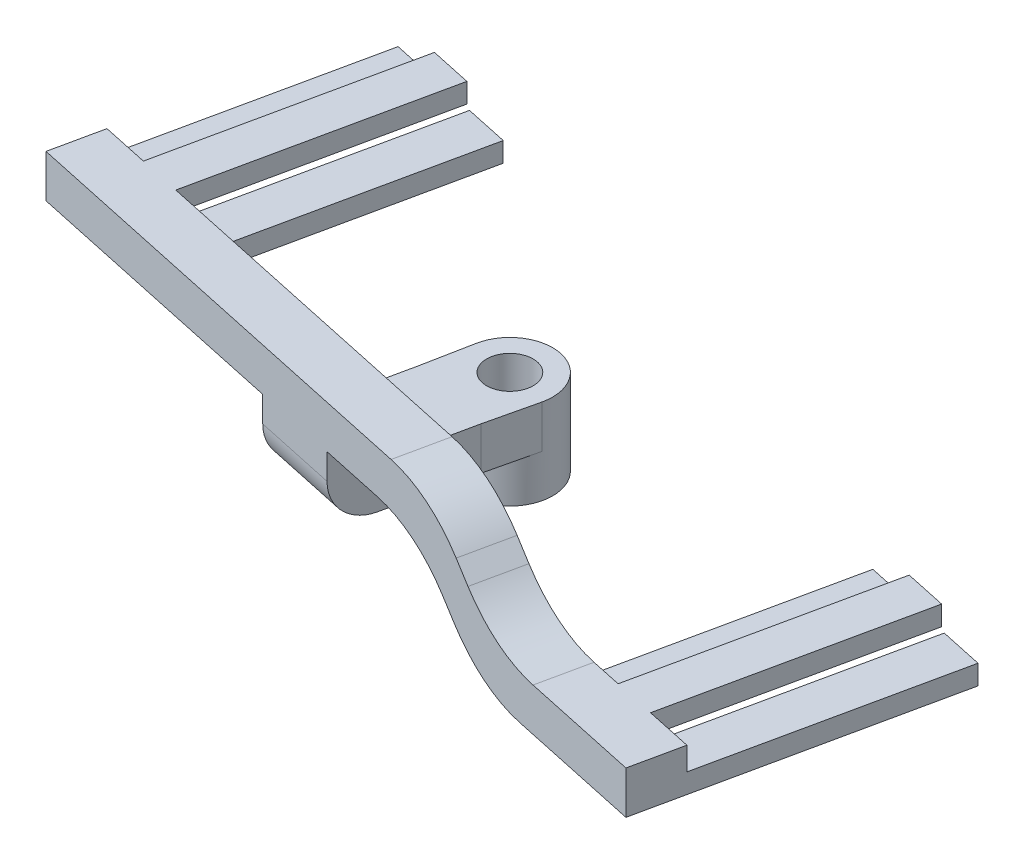
from build123d import *

# Parameters (mm, degrees)
SKETCH1_R             = 3.175
BOSS_EXTRUDE1_DEPTH   = 8.89
F_4_CLEARANCE_HOLE1_D = 3.4544
BOSS_EXTRUDE2_START   = -3.175
BOSS_EXTRUDE2_DEPTH   = 3.175
BOSS_EXTRUDE3_DEPTH   = 3.81
BOSS_EXTRUDE4_START   = -9.525
BOSS_EXTRUDE4_DEPTH   = 3.175
CUT_EXTRUDE1_DEPTH    = 18.185920344
CUT_EXTRUDE2_DEPTH    = 5.08
BOSS_EXTRUDE5_START   = -20.938172
BOSS_EXTRUDE5_DEPTH   = 6.208698
BOSS_EXTRUDE6_DEPTH   = 3.175
FILLET2_R             = 8.89
FILLET3_R             = 1.5875
FILLET4_R             = 3.175
SKETCH16_R            = 3.175
SKETCH16_R_2          = 1.7272
BOSS_EXTRUDE7_DEPTH   = 2.54


with BuildPart() as part:
    # Sketch1 → Boss-Extrude1 (new body)
    with BuildSketch(Plane(origin=(0, 0, 0), x_dir=(1, 0, 0), z_dir=(0, 1, 0))):
        with Locations(Location((0, 0, 0), (0, 0, 270))):
            Circle(SKETCH1_R)
    extrude(amount=BOSS_EXTRUDE1_DEPTH)

    # #4 Clearance Hole1 (through all)
    with Locations(Plane(origin=(0, 8.89, 0), x_dir=(1, 0, 0), z_dir=(0, 1, 0))):
        with Locations((0, 0)):
            Hole(F_4_CLEARANCE_HOLE1_D / 2)

    # Sketch5 → Boss-Extrude2 (add)
    with BuildSketch(Plane(origin=(0, 8.89, 0), x_dir=(1, 0, 0), z_dir=(0, 1, 0)).offset(BOSS_EXTRUDE2_START)):
        with BuildLine():
            Line((-26.325590973, -8.090556636), (8.584422353, -15.580785179))
            Line((8.584422353, -15.580785179), (9.383698549, -11.85556605))
            Line((9.383698549, -11.85556605), (3.175, -10.523439056))
            Line((3.175, -10.523439056), (3.175, 0))
            ThreePointArc((3.175, 0), (0, -3.175), (-3.175, 0))
            Line((-3.175, 0), (-3.175, -9.160994683))
            Line((-3.175, -9.160994683), (-15.592397098, -6.496740696))
            Line((-15.592397098, -6.496740696), (-11.777286014, 11.284502966))
            Line((-11.777286014, 11.284502966), (-21.711203692, 13.415906155))
            Line((-21.711203692, 13.415906155), (-26.325590973, -8.090556636))
        make_face()
    extrude(amount=BOSS_EXTRUDE2_DEPTH)

    # Sketch11 → Boss-Extrude3 (add)
    with BuildSketch(Plane(origin=(-2.818068695, 0, 13.134287577), x_dir=(0.977747803012258, 0, 0.20978377845940036), z_dir=(-0.20978377845940033, 0, 0.9777478030122579))):
        Polygon((11.661996082, 8.89), (12.977124143, 8.89), (19.327124143, 2.54), (21.821996082, 2.54), (21.821996082, -0.635), (18.011996082, -0.635), (11.661996082, 5.715), align=None)
    extrude(amount=-BOSS_EXTRUDE3_DEPTH)

    # Sketch12 → Boss-Extrude4 (add)
    with BuildSketch(Plane(origin=(0, 8.89, 0), x_dir=(1, 0, 0), z_dir=(0, 1, 0)).offset(BOSS_EXTRUDE4_START)):
        Polygon((18.518340032, -17.712188368), (23.132727312, 3.794274423), (33.066644991, 1.662871234), (28.45225771, -19.843591557), align=None)
    extrude(amount=BOSS_EXTRUDE4_DEPTH)

    # Sketch6 → Cut-Extrude1 (cut)
    with BuildSketch(Plane(origin=(1.796318586, 0, -8.372175215), x_dir=(-0.977747803012258, 0, -0.20978377845940016), z_dir=(0.20978377845940016, 0, -0.977747803012258))):
        Polygon((17.142187862, 7.1755), (17.142187862, 5.715), (20.782854529, 5.715), (20.782854529, 7.1755), (24.042521196, 7.1755), (24.042521196, 8.89), (20.528854529, 8.89), (20.528854529, 7.4295), (17.396187862, 7.4295), (17.396187862, 8.89), (13.882521196, 8.89), (13.882521196, 7.1755), align=None)
        Polygon((-28.722329416, 0.8255), (-28.722329416, -0.635), (-25.081662749, -0.635), (-25.081662749, 0.8255), (-21.821996082, 0.8255), (-21.821996082, 2.54), (-25.335662749, 2.54), (-25.335662749, 1.0795), (-28.468329416, 1.0795), (-28.468329416, 2.54), (-31.981996082, 2.54), (-31.981996082, 0.8255), align=None)
    extrude(amount=-CUT_EXTRUDE1_DEPTH, mode=Mode.SUBTRACT)

    # Sketch13 → Cut-Extrude2 (cut)
    with BuildSketch(Plane(origin=(0, 8.89, 0), x_dir=(1, 0, 0), z_dir=(0, 1, 0))):
        Polygon((-3.175, -9.160994683), (3.175, -10.523439056), (3.175, 7.256560944), (-3.175, 7.256560944), align=None)
    extrude(amount=-CUT_EXTRUDE2_DEPTH, mode=Mode.SUBTRACT)


with BuildPart() as cut_extrude2_piece_1:
    # of the separate pieces the step leaves, piece 1, a body of its own (cut_extrude2_pieces)
    add(part.part.solids().sort_by_distance((-18.52407177, 5.715, -12.732080965))[0])

    # Sketch14 → Boss-Extrude5 (add)
    with BuildSketch(Plane(origin=(-23.507522278, 0, -5.04373094), x_dir=(-0.20978377845940016, 0, 0.977747803012258), z_dir=(-0.977747803012258, 0, -0.20978377845940016)).offset(BOSS_EXTRUDE5_START)):
        Polygon((3.81, 0.635), (13.433205921, 0.635), (13.433205921, 5.715), (9.635481661, 5.715), (9.623205921, 5.715), (9.623205921, 3.81), (3.81, 3.81), align=None)
    extrude(amount=-BOSS_EXTRUDE5_DEPTH)



with BuildPart() as cut_extrude2_piece_2:
    # of the separate pieces the step leaves, piece 2, a body of its own (cut_extrude2_pieces)
    add(part.part.solids().sort_by_distance((0, 0, 3.175))[0])


with BuildPart() as cut_extrude2_piece_1_1:
    add(cut_extrude2_piece_1.part)

    add(cut_extrude2_piece_2.part)  # Boss-Extrude6 merges Cut-Extrude2 piece 2
    # Sketch15 → Boss-Extrude6 (add)
    with BuildSketch(Plane(origin=(0, 3.81, 0), x_dir=(1, 0, 0), z_dir=(0, 1, 0))):
        with BuildLine():
            Line((-3.834546879, -3.073977009), (-3.116253173, 0.607940096))
            ThreePointArc((-3.116253173, 0.607940096), (-0.666063497, -3.104349275), (3.091361375, -0.723954316))
            Line((3.091361375, -0.723954316), (2.235994487, -4.37646125))
            Line((2.235994487, -4.37646125), (-3.834546879, -3.073977009))
        make_face()
    extrude(amount=-BOSS_EXTRUDE6_DEPTH)

    # Fillet2
    fillet2_edges = [cut_extrude2_piece_1_1.edges().sort_by_distance(p)[0] for p in [
        (8.984060451, 5.715, 13.718175614),
        (10.269924023, 8.89, 13.994068148),
        (16.478622572, 2.54, 15.326195141),
        (15.192759, -0.635, 15.050302607),
    ]]
    fillet(fillet2_edges, radius=FILLET2_R)

    # Fillet3
    fillet3_edges = [cut_extrude2_piece_1_1.edges().sort_by_distance(p)[0] for p in [
        (-2.01879269, 3.81, 9.409068406),
    ]]
    fillet(fillet3_edges, radius=FILLET3_R)

    # Fillet4
    fillet4_edges = [cut_extrude2_piece_1_1.edges().sort_by_distance(p)[0] for p in [
        (-2.818068886, 0.635, 13.134287535),
    ]]
    fillet(fillet4_edges, radius=FILLET4_R)

    # Sketch16 → Boss-Extrude7 (add)
    with BuildSketch(Plane.XZ):
        with Locations(Location((0, 0, 0), (0, 0, 270))):
            Circle(SKETCH16_R)
        with Locations(Location((0, 0, 0), (0, 0, 270))):
            Circle(SKETCH16_R_2, mode=Mode.SUBTRACT)
    extrude(amount=BOSS_EXTRUDE7_DEPTH)


solid = cut_extrude2_piece_1_1.part
